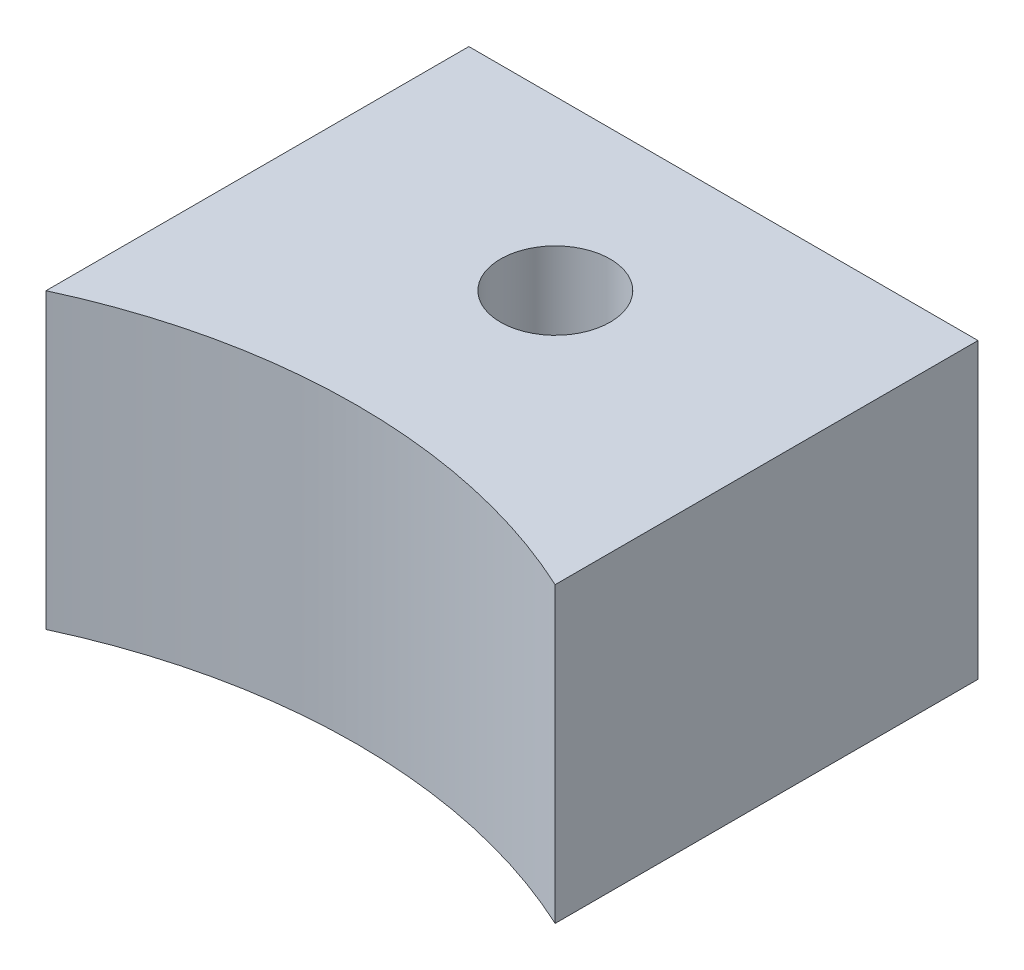
from build123d import *

# Parameters (mm, degrees)
ESQUISSE1_R        = 3.175
BOSS_EXTRU_1_DEPTH = 17


with BuildPart() as part:
    # Esquisse1 → Boss.-Extru.1 (new body)
    with BuildSketch(Plane(origin=(0, 0, 0), x_dir=(1, 0, 0), z_dir=(0, 1, 0))):
        with BuildLine():
            Line((-14.75, 0), (14.75, 0))
            Line((14.75, 0), (14.75, -24.5))
            ThreePointArc((14.75, -24.5), (0, -21.240155954), (-14.75, -24.5))
            Line((-14.75, -24.5), (-14.75, 0))
        make_face()
        with Locations(Location((0, -9.740155954, 0), (0, 0, 270))):
            Circle(ESQUISSE1_R, mode=Mode.SUBTRACT)
    extrude(amount=BOSS_EXTRU_1_DEPTH)


solid = part.part
